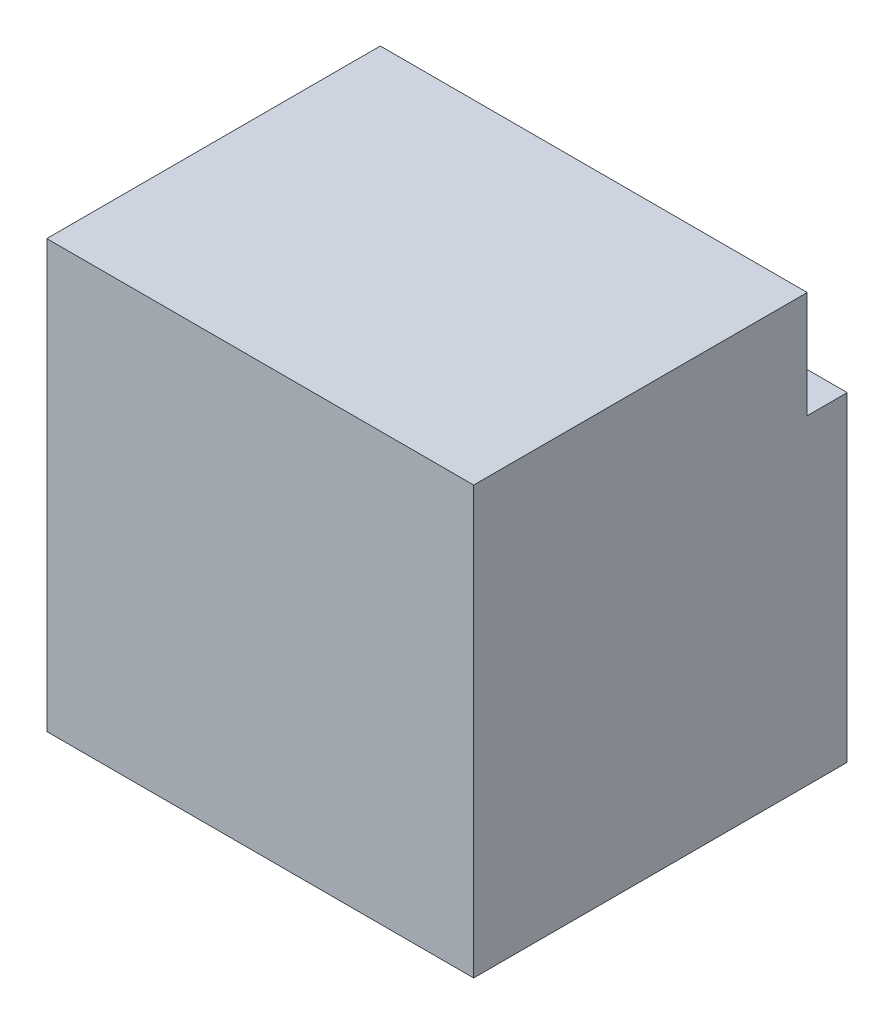
from build123d import *

# Parameters (mm, degrees)
SKIZZE1_W                       = 16
SKIZZE1_H                       = 16
AUFSATZ_LINEAR_AUSTRAGEN1_DEPTH = 14
SKIZZE2_W                       = 11
SKIZZE2_H                       = 7
SCHNITT_LINEAR_AUSTRAGEN1_DEPTH = 10
SKIZZE3_W                       = 7
SKIZZE3_H                       = 2
SCHNITT_LINEAR_AUSTRAGEN2_DEPTH = 10
SKIZZE4_W                       = 2
SKIZZE4_H                       = 1.6
SCHNITT_LINEAR_AUSTRAGEN3_DEPTH = 15
SKIZZE5_W                       = 16
SKIZZE5_H                       = 4
SCHNITT_LINEAR_AUSTRAGEN5_DEPTH = 1.5
SKIZZE6_W                       = 2
SKIZZE6_H                       = 2
SCHNITT_LINEAR_AUSTRAGEN6_DEPTH = 11.5


with BuildPart() as part:
    # Skizze1 → Aufsatz-Linear austragen1 (new body)
    with BuildSketch(Plane.XY):
        Rectangle(SKIZZE1_W, SKIZZE1_H)
    extrude(amount=AUFSATZ_LINEAR_AUSTRAGEN1_DEPTH)

    # Skizze2 → Schnitt-Linear austragen1 (cut)
    with BuildSketch(Plane.XZ.offset(8)):
        with Locations((0, 6.5)):
            Rectangle(SKIZZE2_W, SKIZZE2_H)
    extrude(amount=-SCHNITT_LINEAR_AUSTRAGEN1_DEPTH, mode=Mode.SUBTRACT)

    # Skizze3 → Schnitt-Linear austragen2 (cut)
    with BuildSketch(Plane.XZ.offset(8)):
        with Locations((0, 11)):
            Rectangle(SKIZZE3_W, SKIZZE3_H)
    extrude(amount=-SCHNITT_LINEAR_AUSTRAGEN2_DEPTH, mode=Mode.SUBTRACT)

    # Skizze4 → Schnitt-Linear austragen3 (cut)
    with BuildSketch(Plane.XZ.offset(8)):
        with Locations((5.1, 11.4)):
            Rectangle(SKIZZE4_W, SKIZZE4_H)
        with Locations((-5.1, 11.4)):
            Rectangle(SKIZZE4_W, SKIZZE4_H)
    extrude(amount=-SCHNITT_LINEAR_AUSTRAGEN3_DEPTH, mode=Mode.SUBTRACT)

    # Skizze5 → Schnitt-Linear austragen5 (cut)
    with BuildSketch(Plane(origin=(0, 0, 0), x_dir=(-1, 0, 0), z_dir=(0, 0, -1))):
        with Locations((0, 6)):
            Rectangle(SKIZZE5_W, SKIZZE5_H)
    extrude(amount=-SCHNITT_LINEAR_AUSTRAGEN5_DEPTH, mode=Mode.SUBTRACT)

    # Skizze6 → Schnitt-Linear austragen6 (cut)
    with BuildSketch(Plane(origin=(0, 0, 1.5), x_dir=(-1, 0, 0), z_dir=(0, 0, -1))):
        with Locations((-5.5, 6.5)):
            Rectangle(SKIZZE6_W, SKIZZE6_H)
        with Locations((5.5, 6.5)):
            Rectangle(SKIZZE6_W, SKIZZE6_H)
    extrude(amount=-SCHNITT_LINEAR_AUSTRAGEN6_DEPTH, mode=Mode.SUBTRACT)


solid = part.part
